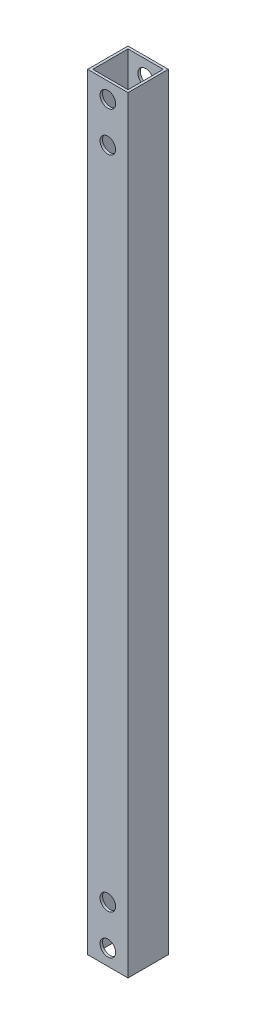
from build123d import *

# Parameters (mm, degrees)
SKETCH1_W               = 25.4
SKETCH1_H               = 25.4
SKETCH1_W_2             = 22.225
SKETCH1_H_2             = 22.225
EXTRUDE_THIN1_DEPTH     = 482.6
F_3_8_CLEARANCE_HOLE1_D = 9.8044


with BuildPart() as part:
    # Sketch1 → Extrude-Thin1 (new body)
    with BuildSketch(Plane(origin=(0, 0, 0), x_dir=(1, 0, 0), z_dir=(0, 1, 0))):
        Rectangle(SKETCH1_W, SKETCH1_H)
        Rectangle(SKETCH1_W_2, SKETCH1_H_2, mode=Mode.SUBTRACT)
    extrude(amount=EXTRUDE_THIN1_DEPTH)

    # 3/8 Clearance Hole1 (through all)
    with Locations(Plane(origin=(0, 0, -12.7), x_dir=(-1, 0, 0), z_dir=(0, 0, -1))):
        with Locations((0, 472.6), (0, 447.6), (0, 35), (0, 10)):
            Hole(F_3_8_CLEARANCE_HOLE1_D / 2)


solid = part.part
